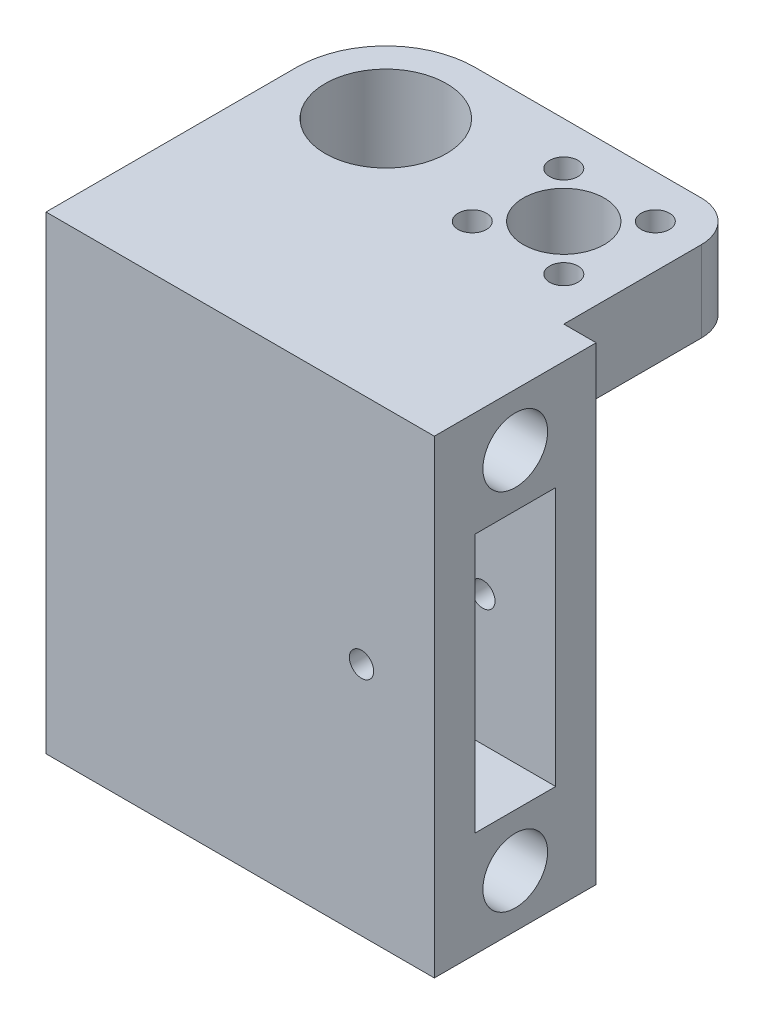
from build123d import *

# Parameters (mm, degrees)
SKETCH_1_R          = 7.5
EXTRUDE_1_DEPTH     = 50
EXTRUDE_START       = -10
EXTRUDE_2_DEPTH     = 10
SKETCH_3_R          = 5
SKETCH_3_R_2        = 1.75
CUT_EXTRUDE_1_DEPTH = 10
SKETCH_4_W          = 44
SKETCH_4_H          = 22
CUT_EXTRUDE_2_DEPTH = 50
SKETCH_5_W          = 48
SKETCH_5_H          = 58
EXTRUDE_3_DEPTH     = 20
SKETCH_6_R          = 4
CUT_EXTRUDE_3_DEPTH = 50
SKETCH_7_W          = 10
SKETCH_7_H          = 32
CUT_EXTRUDE_4_DEPTH = 50
SKETCH_8_R          = 1.5
CUT_EXTRUDE_5_DEPTH = 20


with BuildPart() as part:
    # 草图1 → 凸台-拉伸1 (new body)
    with BuildSketch(Plane(origin=(0, 0, 0), x_dir=(1, 0, 0), z_dir=(0, 1, 0))):
        with BuildLine():
            Line((-11, 0), (-11, -11))
            Line((-11, -11), (11, -11))
            Line((11, -11), (11, 0))
            ThreePointArc((11, 0), (0, 11), (-11, 0))
        make_face()
        with Locations(Location((0, 0, 0), (0, 0, 270))):
            Circle(SKETCH_1_R, mode=Mode.SUBTRACT)
    extrude(amount=EXTRUDE_1_DEPTH)

    # 草图2 → 凸台-拉伸2 (add)
    with BuildSketch(Plane(origin=(0, 50, 0), x_dir=(1, 0, 0), z_dir=(0, 1, 0)).offset(EXTRUDE_START)):
        with BuildLine():
            Line((-11, 11), (0, 11))
            ThreePointArc((0, 11), (-7.778174593, 7.778174593), (-11, 0))
            Line((-11, 0), (-11, -11))
            Line((-11, -11), (-33, -11))
            Line((-33, -11), (-33, 6))
            ThreePointArc((-33, 6), (-31.535533906, 9.535533906), (-28, 11))
            Line((-28, 11), (-11, 11))
        make_face()
    extrude(amount=EXTRUDE_2_DEPTH)

    # 草图3 → 切除-拉伸1 (cut)
    with BuildSketch(Plane(origin=(0, 50, 0), x_dir=(1, 0, 0), z_dir=(0, 1, 0))):
        with Locations(Location((-22, 0, 0), (0, 0, 270))):
            Circle(SKETCH_3_R)
        with Locations(Location((-27.656854249, 5.656854249, 0), (0, 0, 270))):
            Circle(SKETCH_3_R_2)
        with Locations(Location((-16.343145751, 5.656854249, 0), (0, 0, 270))):
            Circle(SKETCH_3_R_2)
        with Locations(Location((-16.343145751, -5.656854249, 0), (0, 0, 270))):
            Circle(SKETCH_3_R_2)
        with Locations(Location((-27.656854249, -5.656854249, 0), (0, 0, 270))):
            Circle(SKETCH_3_R_2)
    extrude(amount=-CUT_EXTRUDE_1_DEPTH, mode=Mode.SUBTRACT)

    # 镜向1: part across plane


with BuildPart() as part_1:
    add(part.part)
    add(part.part.mirror(Plane(origin=(11, 50, 11), x_dir=(0, 0, 1), z_dir=(-1, 0, 0))))

    # 草图4 → 切除-拉伸2 (cut)
    with BuildSketch(Plane.XZ):
        with Locations((-11, 0)):
            Rectangle(SKETCH_4_W, SKETCH_4_H)
    extrude(amount=-CUT_EXTRUDE_2_DEPTH, mode=Mode.SUBTRACT)

    # 草图5 → 凸台-拉伸3 (add)
    with BuildSketch(Plane.XY.offset(11)):
        with Locations((35, 21)):
            Rectangle(SKETCH_5_W, SKETCH_5_H)
    extrude(amount=EXTRUDE_3_DEPTH)

    # 草图6 → 切除-拉伸3 (cut)
    with BuildSketch(Plane(origin=(59, 0, 0), x_dir=(0, 0, -1), z_dir=(1, 0, 0))):
        with Locations(Location((-21, 43.5, 0), (0, 0, 90))):
            Circle(SKETCH_6_R)
        with Locations(Location((-21, -1.5, 0), (0, 0, 90))):
            Circle(SKETCH_6_R)
    extrude(amount=-CUT_EXTRUDE_3_DEPTH, mode=Mode.SUBTRACT)

    # 草图7 → 切除-拉伸4 (cut)
    with BuildSketch(Plane(origin=(59, 0, 0), x_dir=(0, 0, -1), z_dir=(1, 0, 0))):
        with Locations((-21, 21)):
            Rectangle(SKETCH_7_W, SKETCH_7_H)
    extrude(amount=-CUT_EXTRUDE_4_DEPTH, mode=Mode.SUBTRACT)

    # 草图8 → 切除-拉伸5 (cut)
    with BuildSketch(Plane(origin=(0, 0, 11), x_dir=(-1, 0, 0), z_dir=(0, 0, -1))):
        with Locations((-50, 21.08)):
            Circle(SKETCH_8_R)
    extrude(amount=-CUT_EXTRUDE_5_DEPTH, mode=Mode.SUBTRACT)


solid = part_1.part
